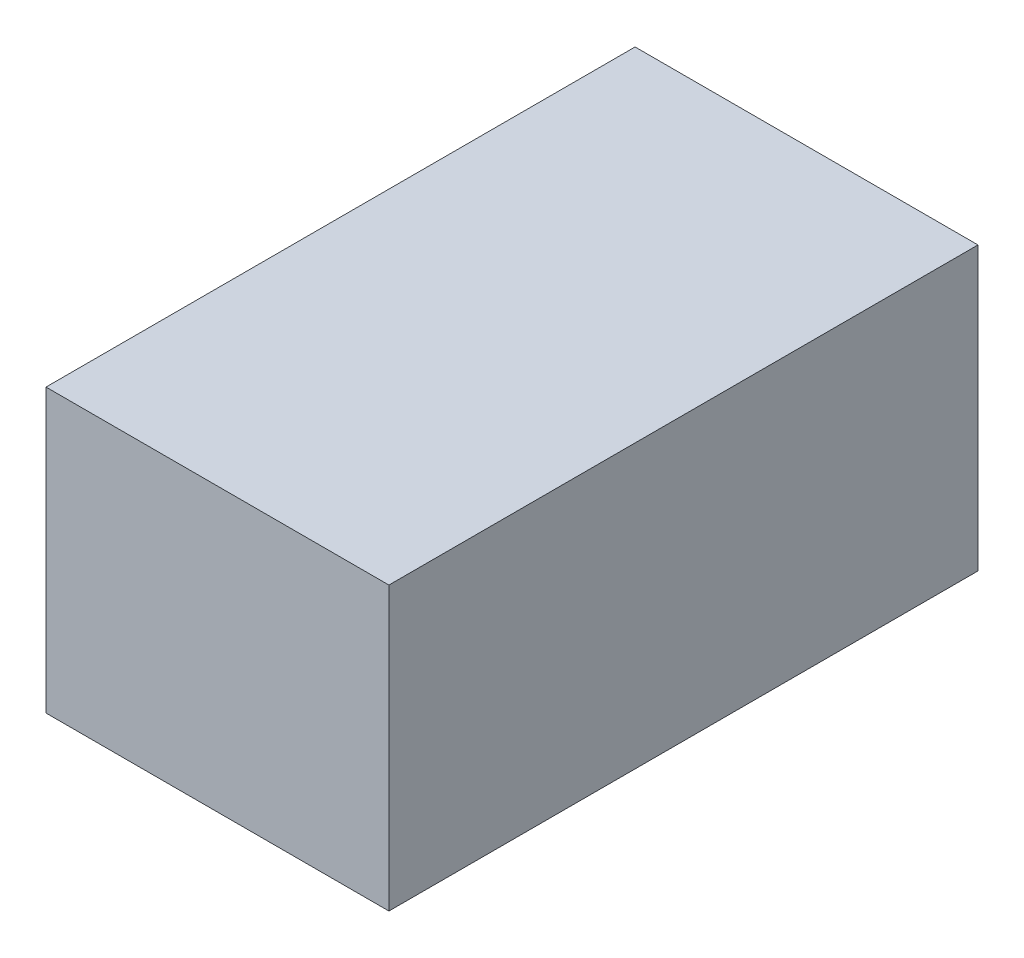
from build123d import *

# Parameters (mm, degrees)
SKETCH1_W           = 140.462
SKETCH1_H           = 241.3
BOSS_EXTRUDE1_DEPTH = 115.65


with BuildPart() as part:
    # Sketch1 → Boss-Extrude1 (new body)
    with BuildSketch(Plane(origin=(0, 0, 0), x_dir=(1, 0, 0), z_dir=(0, 1, 0))):
        with Locations((70.231, -120.65)):
            Rectangle(SKETCH1_W, SKETCH1_H)
    extrude(amount=BOSS_EXTRUDE1_DEPTH)


solid = part.part
